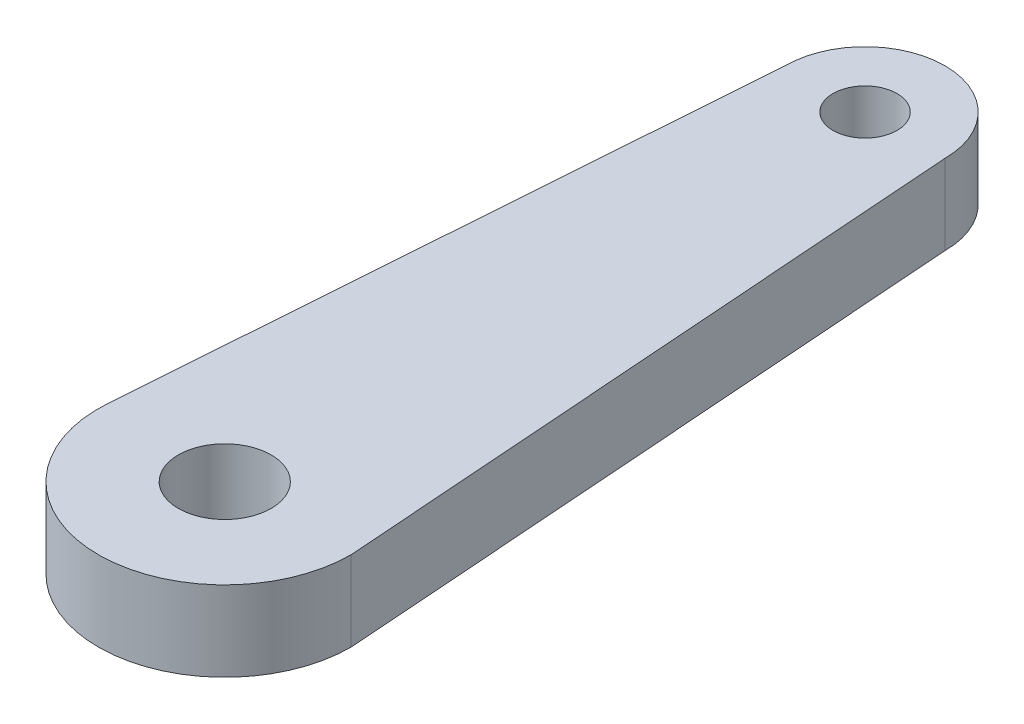
from build123d import *

# Parameters (mm, degrees)
SKETCH1_R           = 2.9
SKETCH1_R_2         = 2
BOSS_EXTRUDE1_DEPTH = 5


with BuildPart() as part:
    # Sketch1 → Boss-Extrude1 (new body)
    with BuildSketch(Plane(origin=(0, 0, 0), x_dir=(1, 0, 0), z_dir=(0, 1, 0))):
        with BuildLine():
            Line((-5, 40), (-7.87901938, 0.575372577))
            ThreePointArc((-7.87901938, 0.575372577), (-0.287877487, -7.894753103), (7.9, 0))
            Line((7.9, 0), (7.817385493, 1.139510448))
            Line((7.817385493, 1.139510448), (5, 40))
            ThreePointArc((5, 40), (0, 45), (-5, 40))
        make_face()
        with Locations(Location((0, 0, 0), (0, 0, 270))):
            Circle(SKETCH1_R, mode=Mode.SUBTRACT)
        with Locations(Location((0, 40, 0), (0, 0, 270))):
            Circle(SKETCH1_R_2, mode=Mode.SUBTRACT)
    extrude(amount=BOSS_EXTRUDE1_DEPTH)


solid = part.part
